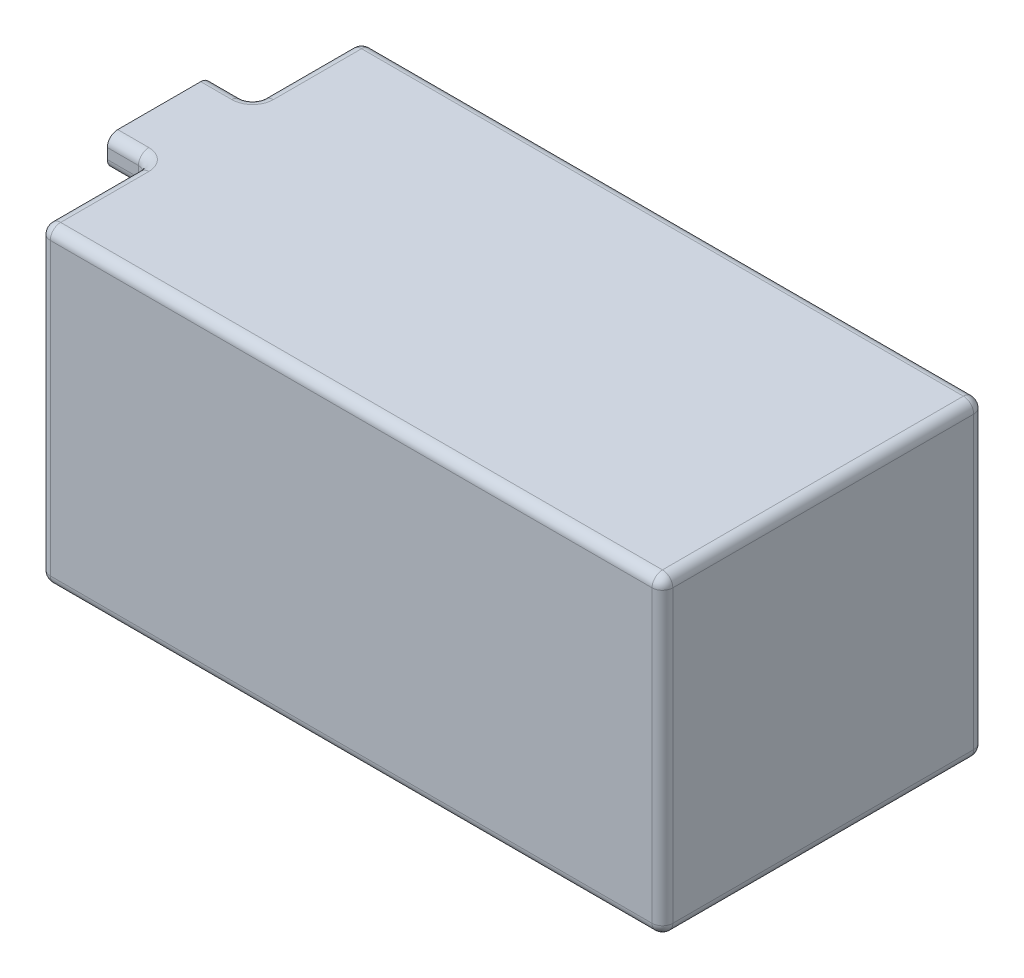
from build123d import *

# Parameters (mm, degrees)
SKETCH1_W           = 76.2
SKETCH1_H           = 39.37
BOSS_EXTRUDE1_DEPTH = 38.1
SKETCH2_W           = 12.7
SKETCH2_H           = 3.81
BOSS_EXTRUDE2_DEPTH = 5.08
FILLET1_R           = 1.27


with BuildPart() as part:
    # Sketch1 → Boss-Extrude1 (new body)
    with BuildSketch(Plane(origin=(0, 0, 0), x_dir=(1, 0, 0), z_dir=(0, 1, 0))):
        Rectangle(SKETCH1_W, SKETCH1_H)
    extrude(amount=BOSS_EXTRUDE1_DEPTH)

    # Sketch2 → Boss-Extrude2 (add)
    with BuildSketch(Plane.ZY.offset(38.1)):
        with Locations((0, 36.195)):
            Rectangle(SKETCH2_W, SKETCH2_H)
    extrude(amount=BOSS_EXTRUDE2_DEPTH)

    # Fillet1
    fillet1_edges = [part.edges().sort_by_distance(p)[0] for p in [
        (-38.1, 38.1, -13.0175),
        (-38.1, 38.1, 13.0175),
        (-38.1, 36.195, -6.35),
        (-40.64, 38.1, -6.35),
        (-38.1, 34.29, 0),
        (0, 38.1, 19.685),
        (-40.64, 34.29, -6.35),
        (-38.1, 36.195, 6.35),
        (-40.64, 34.29, 6.35),
        (-40.64, 38.1, 6.35),
        (38.1, 38.1, 0),
        (0, 0, 19.685),
        (-38.1, 0, 0),
        (0, 0, -19.685),
        (38.1, 0, 0),
        (38.1, 19.05, 19.685),
        (-38.1, 19.05, 19.685),
        (-38.1, 19.05, -19.685),
        (38.1, 19.05, -19.685),
        (0, 38.1, -19.685),
    ]]
    fillet(fillet1_edges, radius=FILLET1_R)


solid = part.part
